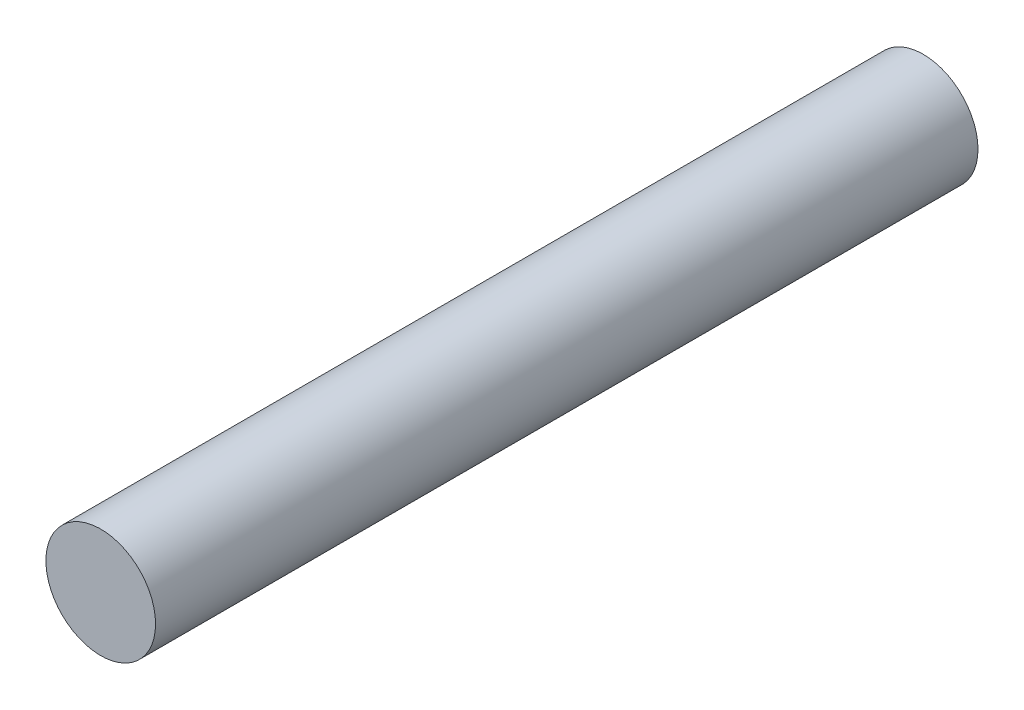
from build123d import *

# Parameters (mm, degrees)
SKETCH1_R           = 2
BOSS_EXTRUDE3_DEPTH = 30


with BuildPart() as part:
    # Sketch1 → Boss-Extrude3 (new body)
    with BuildSketch(Plane.XY):
        Circle(SKETCH1_R)
    extrude(amount=BOSS_EXTRUDE3_DEPTH)


solid = part.part
